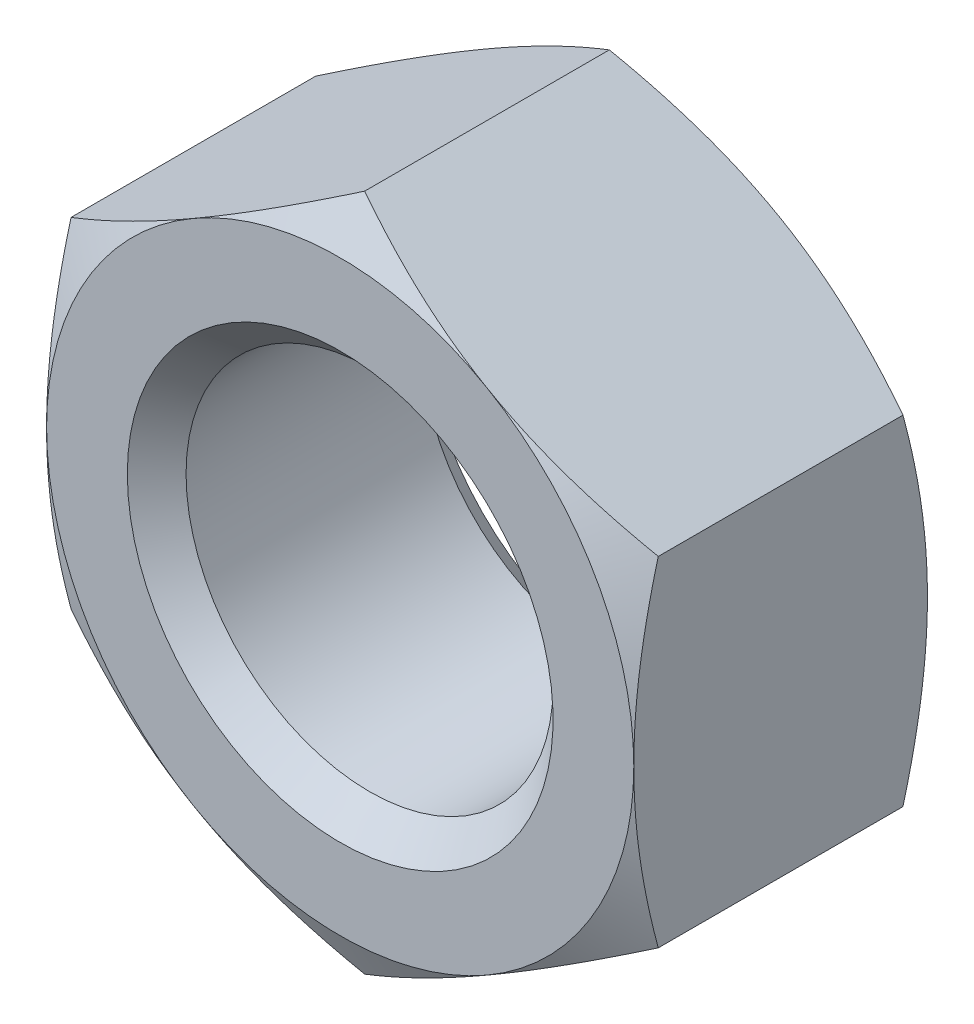
from build123d import *

# Parameters (mm, degrees)
SKETCH1_R           = 2.5
BOSS_EXTRUDE1_DEPTH = 4


with BuildPart() as part:
    # Sketch1 → Boss-Extrude1 (new body)
    with BuildSketch(Plane.XY):
        Polygon((0, -4.618802154), (4, -2.309401077), (4, 2.309401077), (0, 4.618802154), (-4, 2.309401077), (-4, -2.309401077), align=None)
        Circle(SKETCH1_R, mode=Mode.SUBTRACT)
    extrude(amount=BOSS_EXTRUDE1_DEPTH)

    # Sketch2 → Cut-Revolve1 (revolve, cut)
    with BuildSketch(Plane(origin=(0, 0, 0), x_dir=(0, 0, -1), z_dir=(1, 0, 0)), mode=Mode.PRIVATE) as cut_revolve1_sk:
        Polygon((-4, 4.618802154), (-4, 4), (-3.666666667, 4.618802154), align=None)
        Polygon((-0.333333333, 4.618802154), (0, 4.618802154), (0, 4), align=None)
        Polygon((-4, 2.5), (-3.6, 2.5), (-4, 2.9), align=None)
        Polygon((0, 2.5), (-0.4, 2.5), (0, 2.9), align=None)
    revolve(cut_revolve1_sk.sketch.rotate(Axis((0, 0, 0), (0, 0, 1)), 90), axis=Axis((0, 0, 0), (0, 0, 1)), mode=Mode.SUBTRACT)


solid = part.part
